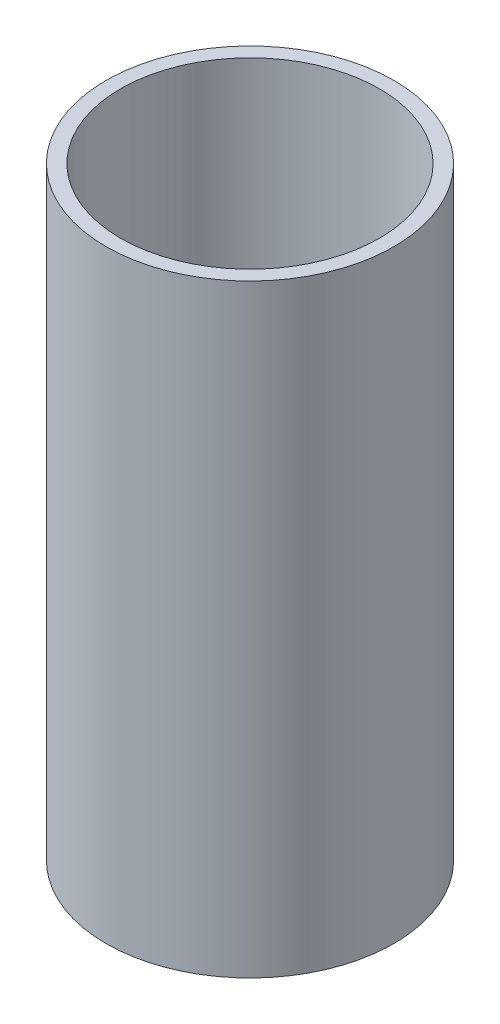
from build123d import *

# Parameters (mm, degrees)
SKETCH1_R           = 11.925
SKETCH1_R_2         = 9.525
BOSS_EXTRUDE1_DEPTH = 50
SKETCH2_R           = 10.8
CUT_EXTRUDE1_DEPTH  = 20
SKETCH3_R           = 10.725
CUT_EXTRUDE2_DEPTH  = 20


with BuildPart() as part:
    # Sketch1 → Boss-Extrude1 (new body)
    with BuildSketch(Plane(origin=(0, 0, 0), x_dir=(1, 0, 0), z_dir=(0, 1, 0))):
        with Locations(Location((0, 0, 0), (0, 0, 270))):
            Circle(SKETCH1_R)
        with Locations(Location((0, 0, 0), (0, 0, 270))):
            Circle(SKETCH1_R_2, mode=Mode.SUBTRACT)
    extrude(amount=BOSS_EXTRUDE1_DEPTH)

    # Sketch2 → Cut-Extrude1 (cut)
    with BuildSketch(Plane.XZ):
        with Locations(Location((0, 0, 0), (0, 0, 270))):
            Circle(SKETCH2_R)
    extrude(amount=-CUT_EXTRUDE1_DEPTH, mode=Mode.SUBTRACT)

    # Sketch3 → Cut-Extrude2 (cut)
    with BuildSketch(Plane(origin=(0, 50, 0), x_dir=(1, 0, 0), z_dir=(0, 1, 0))):
        with Locations(Location((0, 0, 0), (0, 0, 270))):
            Circle(SKETCH3_R)
    extrude(amount=-CUT_EXTRUDE2_DEPTH, mode=Mode.SUBTRACT)


solid = part.part
